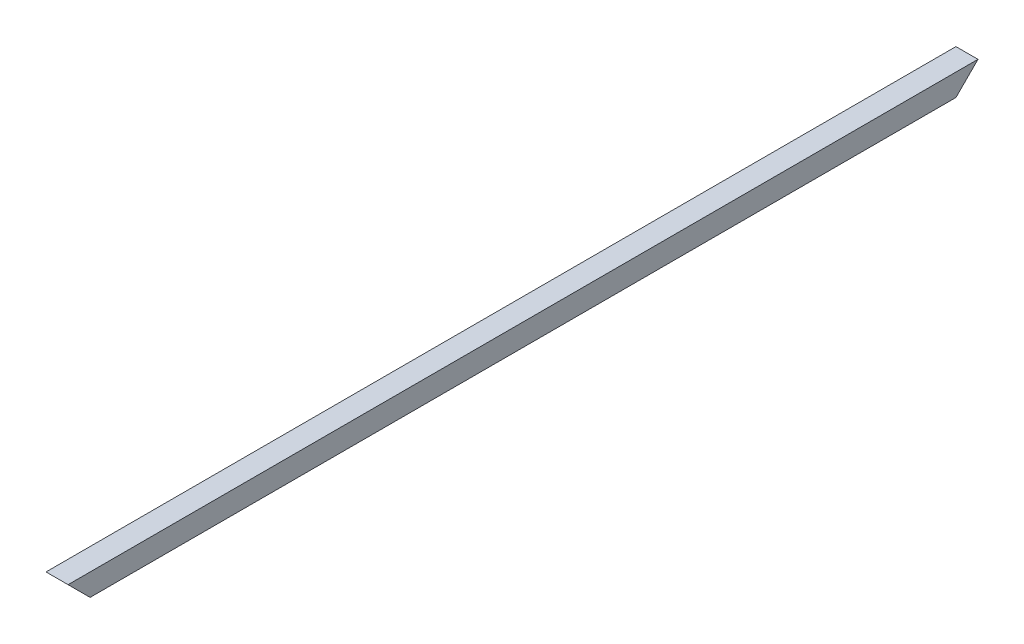
from build123d import *

# Parameters (mm, degrees)
SKETCH1_W           = 40
SKETCH1_H           = 40
SKETCH1_W_2         = 36
SKETCH1_H_2         = 36
BOSS_EXTRUDE1_DEPTH = 1650
CUT_EXTRUDE1_REACH  = 2322.753


with BuildPart() as part:
    # Sketch1 → Boss-Extrude1 (new body)
    with BuildSketch(Plane.XY):
        with Locations((-20, 1611.5)):
            Rectangle(SKETCH1_W, SKETCH1_H)
        with Locations((-20, 1611.5)):
            Rectangle(SKETCH1_W_2, SKETCH1_H_2, mode=Mode.SUBTRACT)
    extrude(amount=-BOSS_EXTRUDE1_DEPTH)

    # Cut-Extrude1: up to this face of the body (flat: up to its plane)
    cut_extrude1_end = Plane(part.part.faces().sort_by_distance((-40, 1611.5, -825))[0])
    # Sketch2 → Cut-Extrude1 (cut, up to the picked face)
    with BuildSketch(Plane(origin=(0, 0, 0), x_dir=(0, 0, -1), z_dir=(1, 0, 0)), mode=Mode.PRIVATE) as cut_extrude1_sk1:
        Polygon((0, 1631.5), (0, 1591.5), (40, 1591.5), align=None)
    cut_extrude1_tool1 = split(extrude(cut_extrude1_sk1.sketch, amount=-CUT_EXTRUDE1_REACH, mode=Mode.PRIVATE), bisect_by=cut_extrude1_end, keep=Keep.BOTH, mode=Mode.PRIVATE)
    # Sketch2 → Cut-Extrude1 (cut, up to the picked face)
    with BuildSketch(Plane(origin=(0, 0, 0), x_dir=(0, 0, -1), z_dir=(1, 0, 0)), mode=Mode.PRIVATE) as cut_extrude1_sk2:
        Polygon((1610, 1591.5), (1650, 1631.5), (1650, 1591.5), align=None)
    cut_extrude1_tool2 = split(extrude(cut_extrude1_sk2.sketch, amount=-CUT_EXTRUDE1_REACH, mode=Mode.PRIVATE), bisect_by=cut_extrude1_end, keep=Keep.BOTH, mode=Mode.PRIVATE)
    add(cut_extrude1_tool1.solids().sort_by(Axis((0, 1604.833333, -13.333333), (-1, 0, 0)))[0], mode=Mode.SUBTRACT)
    add(cut_extrude1_tool2.solids().sort_by(Axis((0, 1604.833333, -1636.666667), (-1, 0, 0)))[0], mode=Mode.SUBTRACT)


solid = part.part
